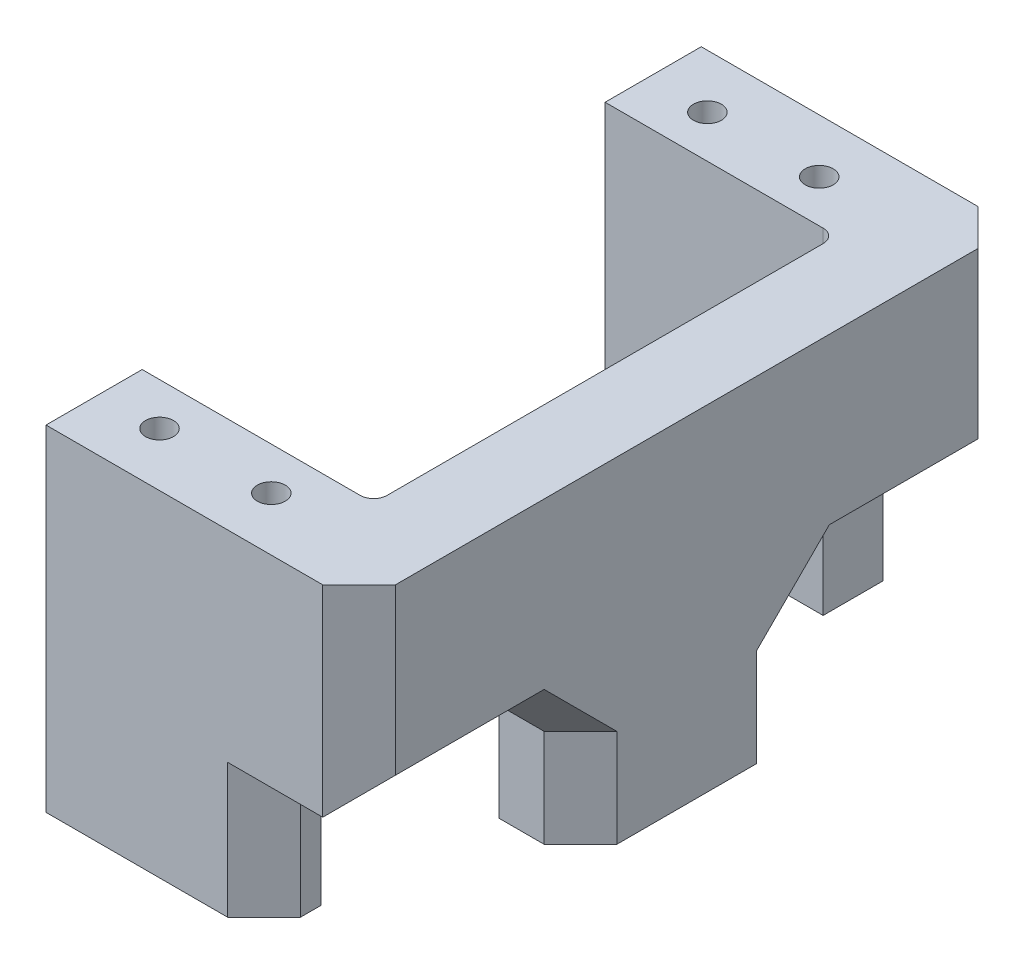
from build123d import *

# Parameters (mm, degrees)
BOSS_EXTRU_1_DEPTH      = 30
ESQUISSE2_W             = 8.5
ESQUISSE2_H             = 19.8
ENL_V_MAT_EXTRU_1_DEPTH = 12
TROU_TARAUD_M31_D       = 2.5
TROU_TARAUD_M31_DEPTH   = 10
TROU_TARAUD_M31_TIP     = 0.751075774
ESQUISSE7_W             = 28
ESQUISSE7_H             = 8.3
BOSS_EXTRU_2_DEPTH      = 18
CHANFREIN3_SIZE         = 3.25
TROU_TARAUD_M32_D       = 2.5
TROU_TARAUD_M32_DEPTH   = 10
TROU_TARAUD_M32_TIP     = 0.751075774
ESQUISSE10_W            = 19.5
ESQUISSE10_H            = 3.5
ENL_V_MAT_EXTRU_2_DEPTH = 10
CHANFREIN4_SIZE         = 1


with BuildPart() as part:
    # Esquisse1 → Boss.-Extru.1 (new body)
    with BuildSketch(Plane(origin=(0, 0, 0), x_dir=(1, 0, 0), z_dir=(0, 1, 0))):
        with BuildLine():
            Line((-9.5, 20.7), (-9.5, 29.3))
            Line((-9.5, 29.3), (18.5, 29.3))
            Line((18.5, 29.3), (18.5, -29.3))
            Line((18.5, -29.3), (-9.5, -29.3))
            Line((-9.5, -29.3), (-9.5, -20.7))
            Line((-9.5, -20.7), (10, -20.7))
            ThreePointArc((10, -20.7), (10.848528137, -20.348528137), (11.2, -19.5))
            Line((11.2, -19.5), (11.2, 19.5))
            ThreePointArc((11.2, 19.5), (10.848528137, 20.348528137), (10, 20.7))
            Line((10, 20.7), (-9.5, 20.7))
        make_face()
    extrude(amount=BOSS_EXTRU_1_DEPTH)

    # Esquisse2 → Enlèv. mat.-Extru.1 (cut)
    with BuildSketch(Plane.XZ):
        with Locations((14.25, 19.4)):
            Rectangle(ESQUISSE2_W, ESQUISSE2_H)
        with Locations((14.25, -19.4)):
            Rectangle(ESQUISSE2_W, ESQUISSE2_H)
    extrude(amount=-ENL_V_MAT_EXTRU_1_DEPTH, mode=Mode.SUBTRACT)

    # Trou taraudé M31
    with Locations(Plane(origin=(0, 0, 0), x_dir=(-1, 0, 0), z_dir=(0, -1, 0))):
        with Locations((-1, 23), (-14.85, 0), (-1, -27)):
            Hole(TROU_TARAUD_M31_D / 2, depth=TROU_TARAUD_M31_DEPTH)
            with Locations((0, 0, -(TROU_TARAUD_M31_DEPTH + TROU_TARAUD_M31_TIP / 2))):  # 118° drill point
                Cone(0, TROU_TARAUD_M31_D / 2, TROU_TARAUD_M31_TIP, mode=Mode.SUBTRACT)

    # Esquisse7 → Boss.-Extru.2 (add)
    with BuildSketch(Plane(origin=(0, 30, 0), x_dir=(1, 0, 0), z_dir=(0, 1, 0))):
        with Locations((4.5, -24.85)):
            Rectangle(ESQUISSE7_W, ESQUISSE7_H)
        with Locations((4.5, 24.85)):
            Rectangle(ESQUISSE7_W, ESQUISSE7_H)
    extrude(amount=-BOSS_EXTRU_2_DEPTH)

    # Chanfrein3
    chanfrein3_edges = [part.edges().sort_by_distance(p)[0] for p in [
        (18.5, 21, -29.3),
        (18.5, 21, 29.3),
        (14.85, 12, 9.5),
        (18.5, 6, 9.5),
        (18.5, 12, 19.4),
        (10, 6, 29.3),
        (10, 6, -29.3),
        (14.85, 12, -9.5),
        (18.5, 12, -19.4),
        (18.5, 6, -9.5),
    ]]
    chamfer(chanfrein3_edges, length=CHANFREIN3_SIZE)

    # Trou taraudé M32
    with Locations(Plane(origin=(0, 30, 0), x_dir=(1, 0, 0), z_dir=(0, 1, 0))):
        with Locations((-4.15, 24.5), (-4.15, -24.5), (5.85, -24.5), (5.85, 24.5)):
            Hole(TROU_TARAUD_M32_D / 2, depth=TROU_TARAUD_M32_DEPTH)
            with Locations((0, 0, -(TROU_TARAUD_M32_DEPTH + TROU_TARAUD_M32_TIP / 2))):  # 118° drill point
                Cone(0, TROU_TARAUD_M32_D / 2, TROU_TARAUD_M32_TIP, mode=Mode.SUBTRACT)

    # Esquisse10 → Enlèv. mat.-Extru.2 (cut)
    with BuildSketch(Plane.XZ):
        with Locations((0.25, 22.45)):
            Rectangle(ESQUISSE10_W, ESQUISSE10_H)
    extrude(amount=-ENL_V_MAT_EXTRU_2_DEPTH, mode=Mode.SUBTRACT)

    # Chanfrein4
    chanfrein4_edges = [part.edges().sort_by_distance(p)[0] for p in [
        (0.25, 10, 24.2),
        (0.25, 10, 20.7),
    ]]
    chamfer(chanfrein4_edges, length=CHANFREIN4_SIZE)


solid = part.part
